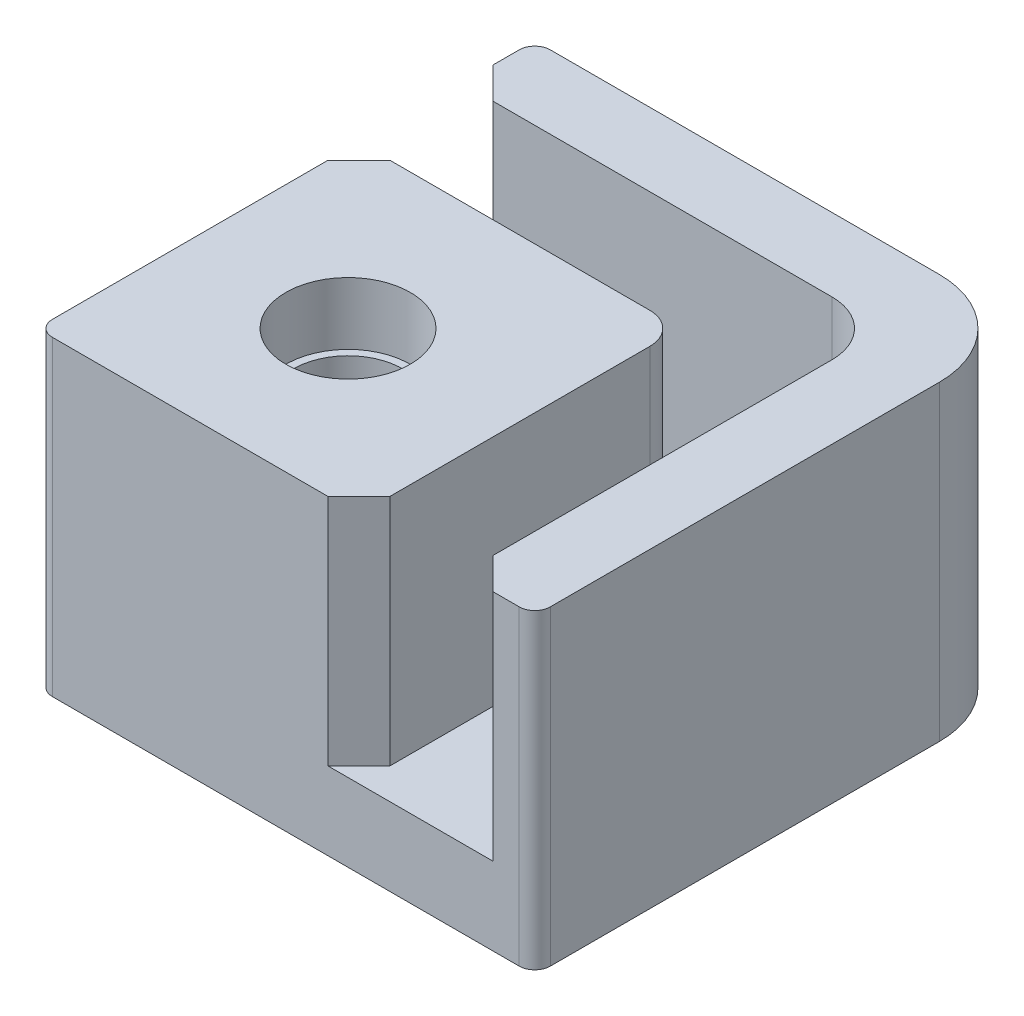
from build123d import *

# Parameters (mm, degrees)
SKETCH1_W           = 16
SKETCH1_H           = 16
BOSS_EXTRUDE1_DEPTH = 10
SKETCH4_R           = 1.75
CUT_EXTRUDE3_DEPTH  = 10
CUT_EXTRUDE4_DEPTH  = 7.5
FILLET1_R           = 1
FILLET2_R           = 1.75
FILLET5_R           = 3
CHAMFER1_SIZE       = 1
FILLET6_R           = 0.5
SKETCH6_R           = 2
CUT_EXTRUDE5_DEPTH  = 2


with BuildPart() as part:
    # Sketch1 → Boss-Extrude1 (new body)
    with BuildSketch(Plane(origin=(0, 0, 0), x_dir=(1, 0, 0), z_dir=(0, 1, 0))):
        with Locations((8, -8)):
            Rectangle(SKETCH1_W, SKETCH1_H)
    extrude(amount=BOSS_EXTRUDE1_DEPTH)

    # Sketch4 → Cut-Extrude3 (cut)
    with BuildSketch(Plane(origin=(0, 10, 0), x_dir=(1, 0, 0), z_dir=(0, 1, 0))):
        with Locations(Location((5, -11, 0), (0, 0, 270))):
            Circle(SKETCH4_R)
    extrude(amount=-CUT_EXTRUDE3_DEPTH, mode=Mode.SUBTRACT)

    # Sketch5 → Cut-Extrude4 (cut)
    with BuildSketch(Plane(origin=(0, 10, 0), x_dir=(1, 0, 0), z_dir=(0, 1, 0))):
        Polygon((0, -2.35), (13.65, -2.35), (13.65, -16), (10.35, -16), (10.35, -5.65), (0, -5.65), align=None)
    extrude(amount=-CUT_EXTRUDE4_DEPTH, mode=Mode.SUBTRACT)

    # Fillet1
    fillet1_edges = [part.edges().sort_by_distance(p)[0] for p in [
        (10.35, 6.25, 5.65),
    ]]
    fillet(fillet1_edges, radius=FILLET1_R)

    # Fillet2
    fillet2_edges = [part.edges().sort_by_distance(p)[0] for p in [
        (13.65, 6.25, 2.35),
    ]]
    fillet(fillet2_edges, radius=FILLET2_R)

    # Fillet5
    fillet5_edges = [part.edges().sort_by_distance(p)[0] for p in [
        (16, 5, 0),
    ]]
    fillet(fillet5_edges, radius=FILLET5_R)

    # Chamfer1
    chamfer1_edges = [part.edges().sort_by_distance(p)[0] for p in [
        (0, 6.25, 5.65),
        (0, 6.25, 2.35),
        (13.65, 6.25, 16),
        (10.35, 6.25, 16),
    ]]
    chamfer(chamfer1_edges, length=CHAMFER1_SIZE)

    # Fillet6
    fillet6_edges = [part.edges().sort_by_distance(p)[0] for p in [
        (0, 5, 0),
        (16, 5, 16),
        (0, 5, 16),
    ]]
    fillet(fillet6_edges, radius=FILLET6_R)

    # Sketch6 → Cut-Extrude5 (cut)
    with BuildSketch(Plane(origin=(0, 10, 0), x_dir=(1, 0, 0), z_dir=(0, 1, 0))):
        with Locations(Location((5, -11, 0), (0, 0, 270))):
            Circle(SKETCH6_R)
    extrude(amount=-CUT_EXTRUDE5_DEPTH, mode=Mode.SUBTRACT)


solid = part.part
